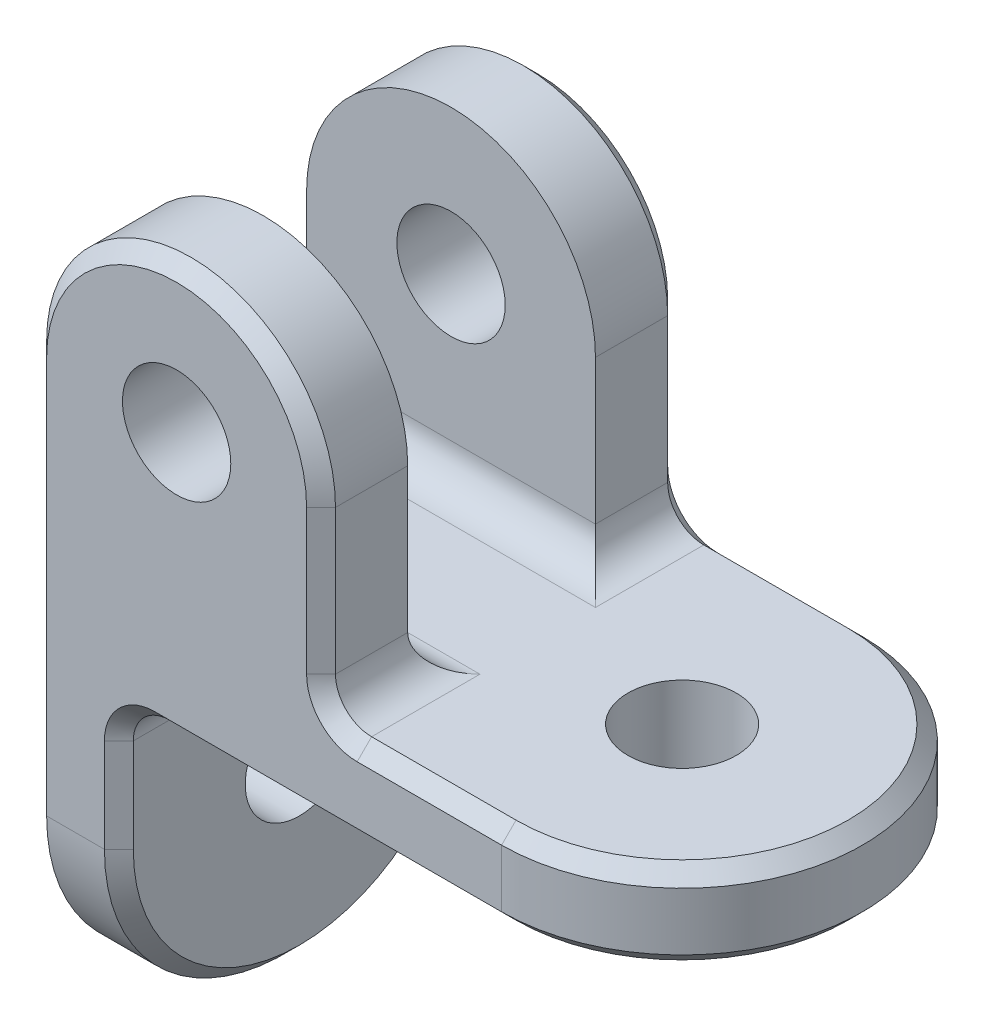
from build123d import *

# Parameters (mm, degrees)
BOSS_EXTRUDE1_DEPTH = 6
BOSS_EXTRUDE2_START = 19
BOSS_EXTRUDE2_DEPTH = 6
BOSS_EXTRUDE3_START = -19
BOSS_EXTRUDE3_DEPTH = 6
BOSS_EXTRUDE4_START = -39
BOSS_EXTRUDE4_DEPTH = 6
SKETCH7_R           = 7.5
CUT_EXTRUDE1_DEPTH  = 25
SKETCH4_R           = 7.5
CUT_EXTRUDE2_DEPTH  = 73.463784058
SKETCH6_R           = 7.5
CUT_EXTRUDE3_DEPTH  = 10
FILLET1_R           = 5
CHAMFER1_SIZE       = 2


with BuildPart() as part:
    # Sketch1 → Boss-Extrude1 (new, symmetric)
    with BuildSketch(Plane(origin=(0, 0, 0), x_dir=(1, 0, 0), z_dir=(0, 1, 0))):
        with BuildLine():
            Line((-45, 25), (20, 25))
            ThreePointArc((20, 25), (45, 0), (20, -25))
            Line((20, -25), (-45, -25))
            Line((-45, -25), (-45, 25))
        make_face()
    extrude(amount=BOSS_EXTRUDE1_DEPTH, both=True)

    # Sketch2 → Boss-Extrude2 (add, symmetric)
    with BuildSketch(Plane.XY.offset(BOSS_EXTRUDE2_START)):
        with BuildLine():
            Line((-45, 6), (-5, 6))
            Line((-5, 6), (-5, 31))
            ThreePointArc((-5, 31), (-25, 51), (-45, 31))
            Line((-45, 31), (-45, 6))
        make_face()
    extrude(amount=BOSS_EXTRUDE2_DEPTH, both=True)

    # Sketch2<2> → Boss-Extrude3 (add, symmetric)
    with BuildSketch(Plane.XY.offset(BOSS_EXTRUDE3_START)):
        with BuildLine():
            Line((-45, 6), (-5, 6))
            Line((-5, 6), (-5, 31))
            ThreePointArc((-5, 31), (-25, 51), (-45, 31))
            Line((-45, 31), (-45, 6))
        make_face()
    extrude(amount=BOSS_EXTRUDE3_DEPTH, both=True)

    # Sketch3 → Boss-Extrude4 (add, symmetric)
    with BuildSketch(Plane(origin=(0, 0, 0), x_dir=(0, 0, -1), z_dir=(1, 0, 0)).offset(BOSS_EXTRUDE4_START)):
        with BuildLine():
            Line((-25, -6), (25, -6))
            Line((25, -6), (25, -24))
            ThreePointArc((25, -24), (0, -49), (-25, -24))
            Line((-25, -24), (-25, -6))
        make_face()
    extrude(amount=BOSS_EXTRUDE4_DEPTH, both=True)

    # Sketch7 → Cut-Extrude1 (cut, symmetric)
    with BuildSketch(Plane.XY):
        with Locations((-25, 31)):
            Circle(SKETCH7_R)
    extrude(amount=CUT_EXTRUDE1_DEPTH, both=True, mode=Mode.SUBTRACT)

    # Sketch4 → Cut-Extrude2 (cut, through all)
    with BuildSketch(Plane(origin=(0, 0, 0), x_dir=(0, 0, -1), z_dir=(1, 0, 0))):
        with Locations((0, -24)):
            Circle(SKETCH4_R)
    extrude(amount=-CUT_EXTRUDE2_DEPTH, mode=Mode.SUBTRACT)

    # Sketch6 → Cut-Extrude3 (cut, symmetric)
    with BuildSketch(Plane(origin=(0, 0, 0), x_dir=(1, 0, 0), z_dir=(0, 1, 0))):
        with Locations((20, 0)):
            Circle(SKETCH6_R)
    extrude(amount=CUT_EXTRUDE3_DEPTH, both=True, mode=Mode.SUBTRACT)

    # Fillet1
    fillet1_edges = [part.edges().sort_by_distance(p)[0] for p in [
        (-33, -6, 0),
        (-25, 6, -13),
        (-5, 6, -19),
        (-25, 6, 13),
        (-5, 6, 19),
    ]]
    fillet(fillet1_edges, radius=FILLET1_R)

    # Chamfer1
    chamfer1_edges = [part.edges().sort_by_distance(p)[0] for p in [
        (45, -6, 0),
        (-4, -6, 25),
        (-4, -6, -25),
        (-31.535533906, -7.464466094, -25),
        (-31.535533906, -7.464466094, 25),
        (-33, -17.5, -25),
        (-33, -17.5, 25),
        (-33, -49, 0),
        (-45, -49, 0),
        (-45, 3.5, 25),
        (-45, 3.5, -25),
        (-25, 51, -25),
        (-5, 21, -25),
        (-3.535533906, 7.464466094, -25),
        (10, 6, -25),
        (45, 6, 0),
        (10, 6, 25),
        (-3.535533906, 7.464466094, 25),
        (-5, 21, 25),
        (-25, 51, 25),
    ]]
    chamfer(chamfer1_edges, length=CHAMFER1_SIZE)


solid = part.part
